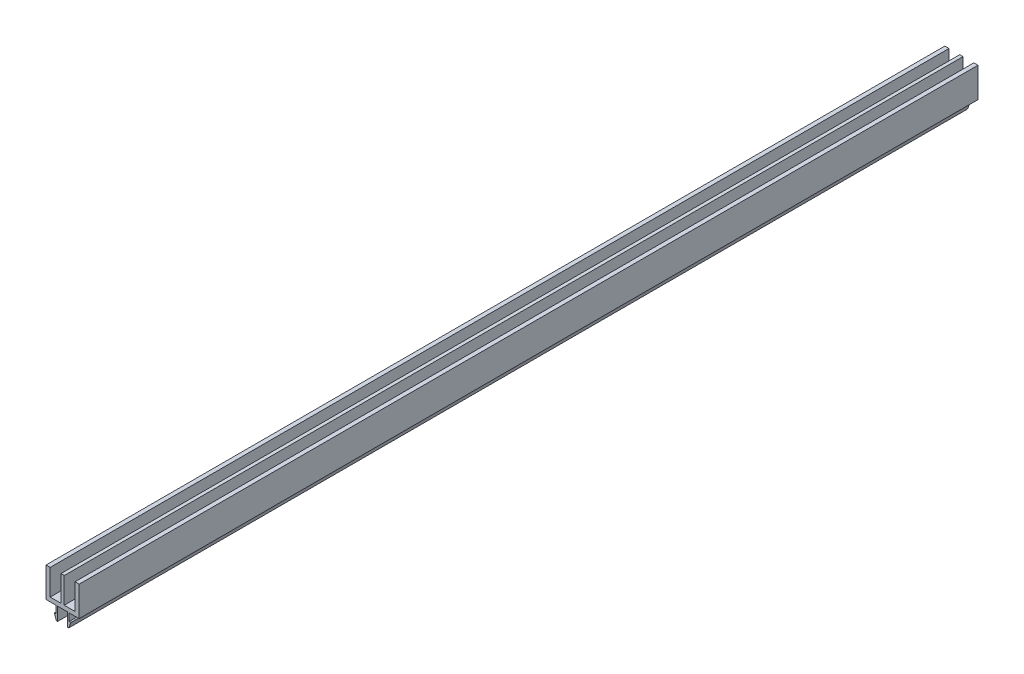
from build123d import *

# Parameters (mm, degrees)
BOSS_EXTRU_1_DEPTH = 542


with BuildPart() as part:
    # Esquisse1 → Boss.-Extru.1 (new body)
    with BuildSketch(Plane.XY.offset(50)):
        Polygon((-1, 2.5), (-7.5, 2.5), (-7.5, 17.999999998), (-10, 17.999999998), (-10, 0), (-4, 0), (-4, -4.5), (-5, -4.5), (-3.75, -8), (-3, -8), (-3, 0), (3, 0), (3, -8), (3.75, -8), (5, -4.5), (4, -4.5), (4, 0), (10, 0), (10, 17.999999998), (7.5, 17.999999998), (7.5, 2.5), (1, 2.5), (1, 17.999999998), (-1, 17.999999998), align=None)
    extrude(amount=-BOSS_EXTRU_1_DEPTH)


solid = part.part
